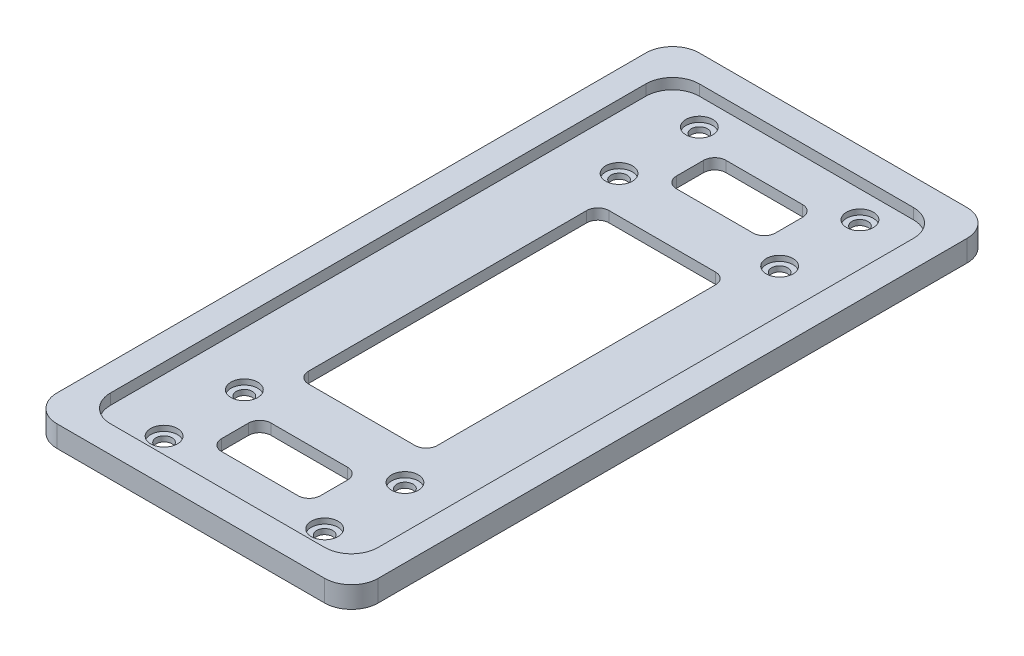
from build123d import *

# Parameters (mm, degrees)
EXTRUDE_1_DEPTH = 4
SKETCH_1_40_R   = 2.5
EXTRUDE_2_DEPTH = 2
SKETCH_1_41_R   = 2.5
SKETCH_1_41_R_2 = 1.5
EXTRUDE_3_DEPTH = 1


with BuildPart() as part:
    # 草图1 → 凸台-拉伸1 (new body)
    with BuildSketch(Plane(origin=(0, 0, 0), x_dir=(1, 0, 0), z_dir=(0, 1, 0))):
        with BuildLine():
            Line((-174.840079727, 131.119726246), (-199.840079727, 131.119726246))
            Line((-199.840079727, 131.119726246), (-224.840079727, 131.119726246))
            ThreePointArc((-224.840079727, 131.119726246), (-228.375613633, 129.655260152), (-229.840079727, 126.119726246))
            Line((-229.840079727, 126.119726246), (-229.840079727, 16.119726246))
            ThreePointArc((-229.840079727, 16.119726246), (-228.375613633, 12.58419234), (-224.840079727, 11.119726246))
            Line((-224.840079727, 11.119726246), (-199.840079727, 11.119726246))
            Line((-199.840079727, 11.119726246), (-174.840079727, 11.119726246))
            ThreePointArc((-174.840079727, 11.119726246), (-171.304545821, 12.58419234), (-169.840079727, 16.119726246))
            Line((-169.840079727, 16.119726246), (-169.840079727, 126.119726246))
            ThreePointArc((-169.840079727, 126.119726246), (-171.304545821, 129.655260152), (-174.840079727, 131.119726246))
        make_face()
        with BuildLine():
            ThreePointArc((-224.840079727, 121.119726246), (-223.375613633, 124.655260152), (-219.840079727, 126.119726246))
            Line((-219.840079727, 126.119726246), (-179.840079727, 126.119726246))
            ThreePointArc((-179.840079727, 126.119726246), (-176.304545821, 124.655260152), (-174.840079727, 121.119726246))
            Line((-174.840079727, 121.119726246), (-174.840079727, 21.119726246))
            ThreePointArc((-174.840079727, 21.119726246), (-176.304545821, 17.58419234), (-179.840079727, 16.119726246))
            Line((-179.840079727, 16.119726246), (-219.840079727, 16.119726246))
            ThreePointArc((-219.840079727, 16.119726246), (-223.375613633, 17.58419234), (-224.840079727, 21.119726246))
            Line((-224.840079727, 21.119726246), (-224.840079727, 121.119726246))
        make_face(mode=Mode.SUBTRACT)
    extrude(amount=EXTRUDE_1_DEPTH)

    # 草图1<40> → 凸台-拉伸2 (add)
    with BuildSketch(Plane(origin=(0, 0, 0), x_dir=(1, 0, 0), z_dir=(0, 1, 0))):
        with BuildLine():
            Line((-179.840079727, 126.119726246), (-219.840079727, 126.119726246))
            ThreePointArc((-219.840079727, 126.119726246), (-223.375613633, 124.655260152), (-224.840079727, 121.119726246))
            Line((-224.840079727, 121.119726246), (-224.840079727, 21.119726246))
            ThreePointArc((-224.840079727, 21.119726246), (-223.375613633, 17.58419234), (-219.840079727, 16.119726246))
            Line((-219.840079727, 16.119726246), (-179.840079727, 16.119726246))
            ThreePointArc((-179.840079727, 16.119726246), (-176.304545821, 17.58419234), (-174.840079727, 21.119726246))
            Line((-174.840079727, 21.119726246), (-174.840079727, 121.119726246))
            ThreePointArc((-174.840079727, 121.119726246), (-176.304545821, 124.655260152), (-179.840079727, 126.119726246))
        make_face()
        with Locations((-214.840082087, 21.119726246)):
            Circle(SKETCH_1_40_R, mode=Mode.SUBTRACT)
        with Locations((-214.840082087, 36.119726246)):
            Circle(SKETCH_1_40_R, mode=Mode.SUBTRACT)
        with BuildLine():
            Line((-192.692955598, 24.003026586), (-206.987206217, 24.003026586))
            ThreePointArc((-206.987206217, 24.003026586), (-208.462425231, 24.614082309), (-209.073480954, 26.089301323))
            Line((-209.073480954, 26.089301323), (-209.073480954, 31.150151169))
            ThreePointArc((-209.073480954, 31.150151169), (-208.462425231, 32.625370183), (-206.987206217, 33.236425906))
            Line((-206.987206217, 33.236425906), (-192.692955598, 33.236425906))
            ThreePointArc((-192.692955598, 33.236425906), (-191.217736584, 32.625370183), (-190.606680861, 31.150151169))
            Line((-190.606680861, 31.150151169), (-190.606680861, 26.089301323))
            ThreePointArc((-190.606680861, 26.089301323), (-191.217736584, 24.614082309), (-192.692955598, 24.003026586))
        make_face(mode=Mode.SUBTRACT)
        with BuildLine():
            Line((-189.897449963, 43.052281864), (-209.782711851, 43.052281864))
            ThreePointArc((-209.782711851, 43.052281864), (-211.257930865, 43.663337587), (-211.868986589, 45.138556602))
            Line((-211.868986589, 45.138556602), (-211.868986589, 97.10089589))
            ThreePointArc((-211.868986589, 97.10089589), (-211.257930865, 98.576114904), (-209.782711851, 99.187170628))
            Line((-209.782711851, 99.187170628), (-189.897449963, 99.187170628))
            ThreePointArc((-189.897449963, 99.187170628), (-188.422230949, 98.576114904), (-187.811175226, 97.10089589))
            Line((-187.811175226, 97.10089589), (-187.811175226, 45.138556602))
            ThreePointArc((-187.811175226, 45.138556602), (-188.422230949, 43.663337587), (-189.897449963, 43.052281864))
        make_face(mode=Mode.SUBTRACT)
        with Locations((-184.840079727, 21.119726246)):
            Circle(SKETCH_1_40_R, mode=Mode.SUBTRACT)
        with Locations((-184.840079727, 36.119726246)):
            Circle(SKETCH_1_40_R, mode=Mode.SUBTRACT)
        with Locations((-214.840082087, 106.119726246)):
            Circle(SKETCH_1_40_R, mode=Mode.SUBTRACT)
        with Locations((-214.840082087, 121.119726246)):
            Circle(SKETCH_1_40_R, mode=Mode.SUBTRACT)
        with BuildLine():
            Line((-192.692955598, 109.003026586), (-206.987206217, 109.003026586))
            ThreePointArc((-206.987206217, 109.003026586), (-208.462425231, 109.614082309), (-209.073480954, 111.089301323))
            Line((-209.073480954, 111.089301323), (-209.073480954, 116.150151169))
            ThreePointArc((-209.073480954, 116.150151169), (-208.462425231, 117.625370183), (-206.987206217, 118.236425906))
            Line((-206.987206217, 118.236425906), (-192.692955598, 118.236425906))
            ThreePointArc((-192.692955598, 118.236425906), (-191.217736584, 117.625370183), (-190.606680861, 116.150151169))
            Line((-190.606680861, 116.150151169), (-190.606680861, 111.089301323))
            ThreePointArc((-190.606680861, 111.089301323), (-191.217736584, 109.614082309), (-192.692955598, 109.003026586))
        make_face(mode=Mode.SUBTRACT)
        with Locations((-184.840079727, 106.119726246)):
            Circle(SKETCH_1_40_R, mode=Mode.SUBTRACT)
        with Locations((-184.840079727, 121.119726246)):
            Circle(SKETCH_1_40_R, mode=Mode.SUBTRACT)
    extrude(amount=EXTRUDE_2_DEPTH)

    # 草图1<41> → 凸台-拉伸3 (add)
    # profile 1 of 8: a face of its own
    with BuildSketch(Plane(origin=(0, 0, 0), x_dir=(1, 0, 0), z_dir=(0, 1, 0))):
        with Locations((-184.840079727, 121.119726246)):
            Circle(SKETCH_1_41_R)
        with Locations((-184.840079727, 121.119726246)):
            Circle(SKETCH_1_41_R_2, mode=Mode.SUBTRACT)
    # profile 2 of 8: a face of its own
    with BuildSketch(Plane(origin=(0, 0, 0), x_dir=(1, 0, 0), z_dir=(0, 1, 0))):
        with Locations((-214.840082087, 121.119726246)):
            Circle(SKETCH_1_41_R)
        with Locations((-214.840082087, 121.119726246)):
            Circle(SKETCH_1_41_R_2, mode=Mode.SUBTRACT)
    # profile 3 of 8: a face of its own
    with BuildSketch(Plane(origin=(0, 0, 0), x_dir=(1, 0, 0), z_dir=(0, 1, 0))):
        with Locations((-214.840082087, 21.119726246)):
            Circle(SKETCH_1_41_R)
        with Locations((-214.840082087, 21.119726246)):
            Circle(SKETCH_1_41_R_2, mode=Mode.SUBTRACT)
    # profile 4 of 8: a face of its own
    with BuildSketch(Plane(origin=(0, 0, 0), x_dir=(1, 0, 0), z_dir=(0, 1, 0))):
        with Locations((-184.840079727, 21.119726246)):
            Circle(SKETCH_1_41_R)
        with Locations((-184.840079727, 21.119726246)):
            Circle(SKETCH_1_41_R_2, mode=Mode.SUBTRACT)
    # profile 5 of 8: a face of its own
    with BuildSketch(Plane(origin=(0, 0, 0), x_dir=(1, 0, 0), z_dir=(0, 1, 0))):
        with Locations((-214.840082087, 106.119726246)):
            Circle(SKETCH_1_41_R)
        with Locations((-214.840082087, 106.119726246)):
            Circle(SKETCH_1_41_R_2, mode=Mode.SUBTRACT)
    # profile 6 of 8: a face of its own
    with BuildSketch(Plane(origin=(0, 0, 0), x_dir=(1, 0, 0), z_dir=(0, 1, 0))):
        with Locations((-184.840079727, 36.119726246)):
            Circle(SKETCH_1_41_R)
        with Locations((-184.840079727, 36.119726246)):
            Circle(SKETCH_1_41_R_2, mode=Mode.SUBTRACT)
    # profile 7 of 8: a face of its own
    with BuildSketch(Plane(origin=(0, 0, 0), x_dir=(1, 0, 0), z_dir=(0, 1, 0))):
        with Locations((-214.840082087, 36.119726246)):
            Circle(SKETCH_1_41_R)
        with Locations((-214.840082087, 36.119726246)):
            Circle(SKETCH_1_41_R_2, mode=Mode.SUBTRACT)
    # profile 8 of 8: a face of its own
    with BuildSketch(Plane(origin=(0, 0, 0), x_dir=(1, 0, 0), z_dir=(0, 1, 0))):
        with Locations((-184.840079727, 106.119726246)):
            Circle(SKETCH_1_41_R)
        with Locations((-184.840079727, 106.119726246)):
            Circle(SKETCH_1_41_R_2, mode=Mode.SUBTRACT)
    extrude(amount=EXTRUDE_3_DEPTH)


solid = part.part
